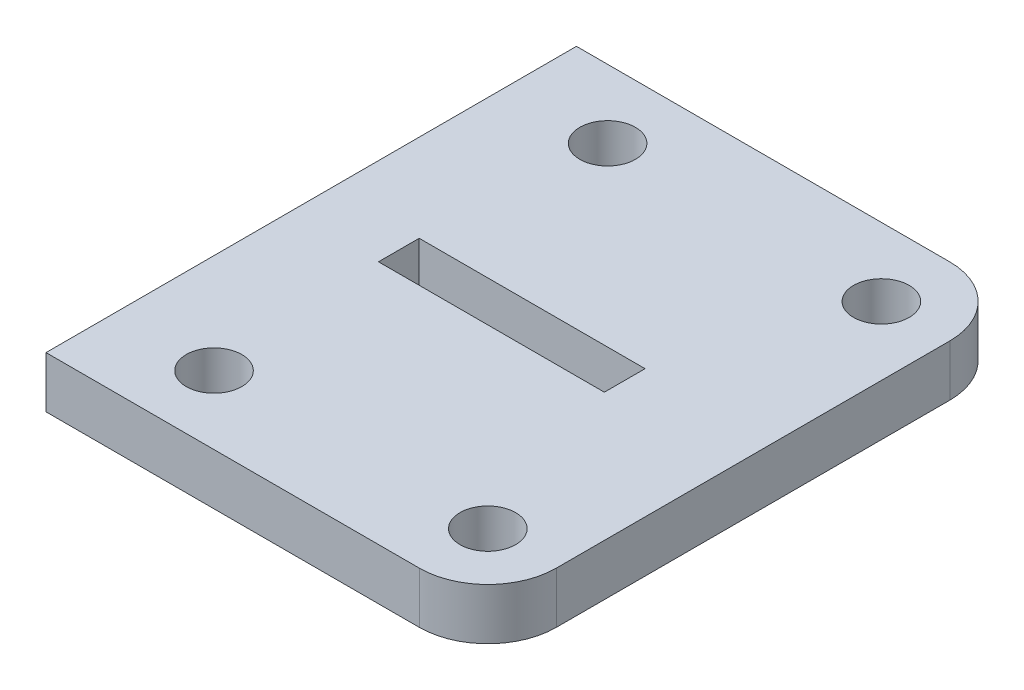
from build123d import *

# Parameters (mm, degrees)
RESSALTO_EXTRUS_O1_DEPTH = 30
ESBO_O2_W                = 12
ESBO_O2_H                = 94
CORTE_EXTRUS_O1_DEPTH    = 118.541482039
ESBO_O3_W                = 30
ESBO_O3_H                = 10
CORTE_EXTRUS_O2_DEPTH    = 118.541482039
ESBO_O4_W                = 3.6
ESBO_O4_H                = 30
CORTE_EXTRUS_O3_DEPTH    = 108.498837203
ESBO_O5_W                = 56.4
ESBO_O5_H                = 6
RESSALTO_EXTRUS_O2_DEPTH = 16
ESBO_O6_W                = 56.4
ESBO_O6_H                = 6
RESSALTO_EXTRUS_O3_DEPTH = 16
FILETE1_R                = 8
FILETE2_R                = 8
FILETE3_R                = 8
FILETE4_R                = 4
ESBO_O7_R                = 3.175
CORTE_EXTRUS_O4_DEPTH    = 113.943171551
ESBO_O8_R                = 3.25
CORTE_EXTRUS_O5_DEPTH    = 112.143870726
ESBO_O9_W                = 56.4
ESBO_O9_H                = 62
CORTE_EXTRUS_O6_DEPTH    = 112.143870726
ESBO_O10_W               = 26.4
ESBO_O10_H               = 4.76
CORTE_EXTRUS_O7_DEPTH    = 74.027118251
ESBO_O11_W               = 4.76
ESBO_O11_H               = 62
CORTE_EXTRUS_O8_DEPTH    = 74.027118251


with BuildPart() as part:
    # Esboço1 → Ressalto-extrusão1 (new body)
    with BuildSketch(Plane.XY):
        Polygon((0, 0), (0, 100), (60, 0), align=None)
    extrude(amount=RESSALTO_EXTRUS_O1_DEPTH)

    # Esboço2 → Corte-extrusão1 (cut, through all)
    with BuildSketch(Plane.ZY.offset(-6)):
        with Locations((24, 53)):
            Rectangle(ESBO_O2_W, ESBO_O2_H)
        with Locations((6, 53)):
            Rectangle(ESBO_O2_W, ESBO_O2_H)
    extrude(amount=-CORTE_EXTRUS_O1_DEPTH, mode=Mode.SUBTRACT)

    # Esboço3 → Corte-extrusão2 (cut, through all)
    with BuildSketch(Plane(origin=(6, 0, 0), x_dir=(0, 0, -1), z_dir=(1, 0, 0))):
        with Locations((-15, 95)):
            Rectangle(ESBO_O3_W, ESBO_O3_H)
    extrude(amount=-CORTE_EXTRUS_O2_DEPTH, mode=Mode.SUBTRACT)

    # Esboço4 → Corte-extrusão3 (cut, through all)
    with BuildSketch(Plane(origin=(0, 6, 0), x_dir=(1, 0, 0), z_dir=(0, 1, 0))):
        with Locations((58.2, -15)):
            Rectangle(ESBO_O4_W, ESBO_O4_H)
    extrude(amount=-CORTE_EXTRUS_O3_DEPTH, mode=Mode.SUBTRACT)

    # Esboço5 → Ressalto-extrusão2 (add)
    with BuildSketch(Plane.XY.offset(30)):
        with Locations((28.2, 3)):
            Rectangle(ESBO_O5_W, ESBO_O5_H)
    extrude(amount=RESSALTO_EXTRUS_O2_DEPTH)

    # Esboço6 → Ressalto-extrusão3 (add)
    with BuildSketch(Plane(origin=(0, 0, 0), x_dir=(-1, 0, 0), z_dir=(0, 0, -1))):
        with Locations((-28.2, 3)):
            Rectangle(ESBO_O6_W, ESBO_O6_H)
    extrude(amount=RESSALTO_EXTRUS_O3_DEPTH)

    # Filete1
    filete1_edges = [part.edges().sort_by_distance(p)[0] for p in [
        (3, 6, 0),
        (3, 6, 30),
    ]]
    fillet(filete1_edges, radius=FILETE1_R)

    # Filete2
    filete2_edges = [part.edges().sort_by_distance(p)[0] for p in [
        (56.4, 3, -16),
        (56.4, 3, 46),
    ]]
    fillet(filete2_edges, radius=FILETE2_R)

    # Filete3
    filete3_edges = [part.edges().sort_by_distance(p)[0] for p in [
        (3, 90, 30),
        (3, 90, 0),
    ]]
    fillet(filete3_edges, radius=FILETE3_R)

    # Filete4
    filete4_edges = [part.edges().sort_by_distance(p)[0] for p in [
        (31.2, 6, 18),
        (31.2, 6, 12),
    ]]
    fillet(filete4_edges, radius=FILETE4_R)

    # Esboço7 → Corte-extrusão4 (cut, through all)
    with BuildSketch(Plane(origin=(6, 0, 0), x_dir=(0, 0, -1), z_dir=(1, 0, 0))):
        with Locations((-23, 78)):
            Circle(ESBO_O7_R)
        with Locations((-23, 48)):
            Circle(ESBO_O7_R)
        with Locations((-23, 18)):
            Circle(ESBO_O7_R)
        with Locations(Location((-7, 18, 0), (0, 0, 180))):
            Circle(ESBO_O7_R)
        with Locations(Location((-7, 48, 0), (0, 0, 180))):
            Circle(ESBO_O7_R)
        with Locations(Location((-7, 78, 0), (0, 0, 180))):
            Circle(ESBO_O7_R)
    extrude(amount=-CORTE_EXTRUS_O4_DEPTH, mode=Mode.SUBTRACT)

    # Esboço8 → Corte-extrusão5 (cut, through all)
    with BuildSketch(Plane(origin=(0, 6, 0), x_dir=(1, 0, 0), z_dir=(0, 1, 0))):
        with Locations(Location((48.4, 8, 0), (0, 0, 270))):
            Circle(ESBO_O8_R)
        with Locations(Location((48.4, -38, 0), (0, 0, 270))):
            Circle(ESBO_O8_R)
        with Locations(Location((16.4, -38, 0), (0, 0, 270))):
            Circle(ESBO_O8_R)
        with Locations(Location((16.4, 8, 0), (0, 0, 270))):
            Circle(ESBO_O8_R)
    extrude(amount=-CORTE_EXTRUS_O5_DEPTH, mode=Mode.SUBTRACT)

    # Esboço9 → Corte-extrusão6 (cut, through all)
    with BuildSketch(Plane(origin=(0, 6, 0), x_dir=(1, 0, 0), z_dir=(0, 1, 0))):
        with Locations((28.2, -15)):
            Rectangle(ESBO_O9_W, ESBO_O9_H)
    extrude(amount=CORTE_EXTRUS_O6_DEPTH, mode=Mode.SUBTRACT)

    # Esboço10 → Corte-extrusão7 (cut, through all)
    with BuildSketch(Plane(origin=(0, 6, 0), x_dir=(1, 0, 0), z_dir=(0, 1, 0))):
        with Locations((28.2, -15)):
            Rectangle(ESBO_O10_W, ESBO_O10_H)
    extrude(amount=-CORTE_EXTRUS_O7_DEPTH, mode=Mode.SUBTRACT)

    # Esboço11 → Corte-extrusão8 (cut, through all)
    with BuildSketch(Plane(origin=(0, 6, 0), x_dir=(1, 0, 0), z_dir=(0, 1, 0))):
        with Locations((2.38, -15)):
            Rectangle(ESBO_O11_W, ESBO_O11_H)
    extrude(amount=-CORTE_EXTRUS_O8_DEPTH, mode=Mode.SUBTRACT)


solid = part.part
